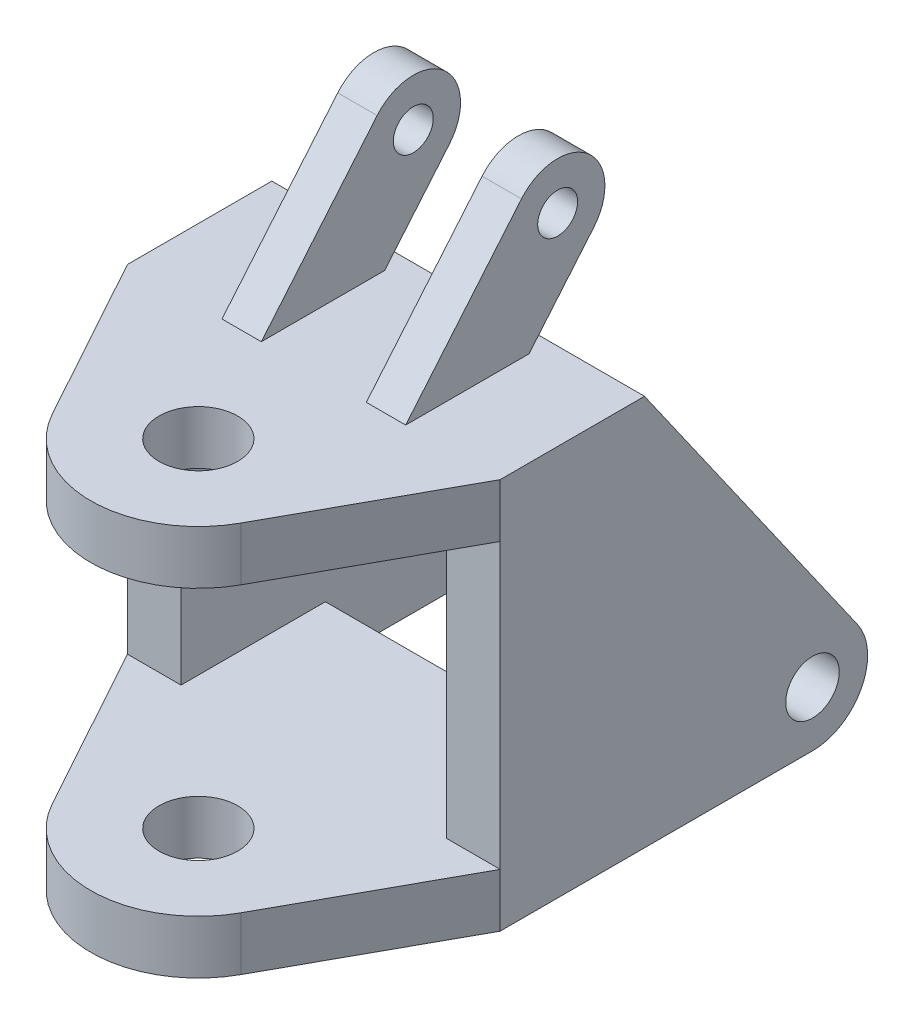
from build123d import *

# Parameters (mm, degrees)
SKETCH1_R           = 75
BOSS_EXTRUDE1_DEPTH = 102
SKETCH3_R           = 51
BOSS_EXTRUDE2_DEPTH = 102
SKETCH4_R           = 38
BOSS_EXTRUDE3_DEPTH = 75


with BuildPart() as part:
    # Sketch1 → Boss-Extrude1 (new body)
    with BuildSketch(Plane(origin=(0, 0, 0), x_dir=(1, 0, 0), z_dir=(0, 1, 0))):
        with BuildLine():
            Line((-179.614887026, -98.810385884), (-355, 220))
            Line((-355, 220), (-355, 495))
            Line((-355, 495), (355, 495))
            Line((355, 495), (355, 220))
            Line((355, 220), (179.614887026, -98.810385884))
            ThreePointArc((179.614887026, -98.810385884), (0, -205), (-179.614887026, -98.810385884))
        make_face()
        with Locations(Location((0, 0, 0), (0, 0, 270))):
            Circle(SKETCH1_R, mode=Mode.SUBTRACT)
    boss_extrude1 = extrude(amount=BOSS_EXTRUDE1_DEPTH)

    # Sketch3 → Boss-Extrude2 (add)
    with BuildSketch(Plane(origin=(355, 0, 0), x_dir=(0, 0, -1), z_dir=(1, 0, 0))):
        with BuildLine():
            Line((220, 0), (220, 745))
            Line((220, 745), (495, 745))
            Line((495, 745), (901.007583532, 165.230354266))
            ThreePointArc((901.007583532, 165.230354266), (908.13749835, 56.5190099), (815, 0))
            Line((815, 0), (220, 0))
        make_face()
        with Locations((815, 105)):
            Circle(SKETCH3_R, mode=Mode.SUBTRACT)
    boss_extrude2 = extrude(amount=-BOSS_EXTRUDE2_DEPTH)

    # Mirror1: Boss-Extrude2 across plane
    add(boss_extrude2.mirror(Plane(origin=(0, 0, 0), x_dir=(0, 0, 1), z_dir=(1, 0, 0))))

    # Mirror2: Boss-Extrude1 across plane
    add(boss_extrude1.mirror(Plane(origin=(0, 372.5, 0), x_dir=(0, 0, 1), z_dir=(0, -1, 0))))

    # Sketch4 → Boss-Extrude3 (add)
    with BuildSketch(Plane(origin=(100, 0, 0), x_dir=(0, 0, -1), z_dir=(1, 0, 0))):
        with BuildLine():
            Line((440.558080551, 1007.850884872), (220, 745))
            Line((220, 745), (454.97331208, 745))
            Line((454.97331208, 745), (578.446080312, 892.149115128))
            ThreePointArc((578.446080312, 892.149115128), (567.352965303, 1018.943999881), (440.558080551, 1007.850884872))
        make_face()
        with Locations((509.502080431, 950)):
            Circle(SKETCH4_R, mode=Mode.SUBTRACT)
    boss_extrude3 = extrude(amount=BOSS_EXTRUDE3_DEPTH)

    # Mirror3: Boss-Extrude3 across plane
    add(boss_extrude3.mirror(Plane(origin=(0, 0, 0), x_dir=(0, 0, 1), z_dir=(1, 0, 0))))


solid = part.part
